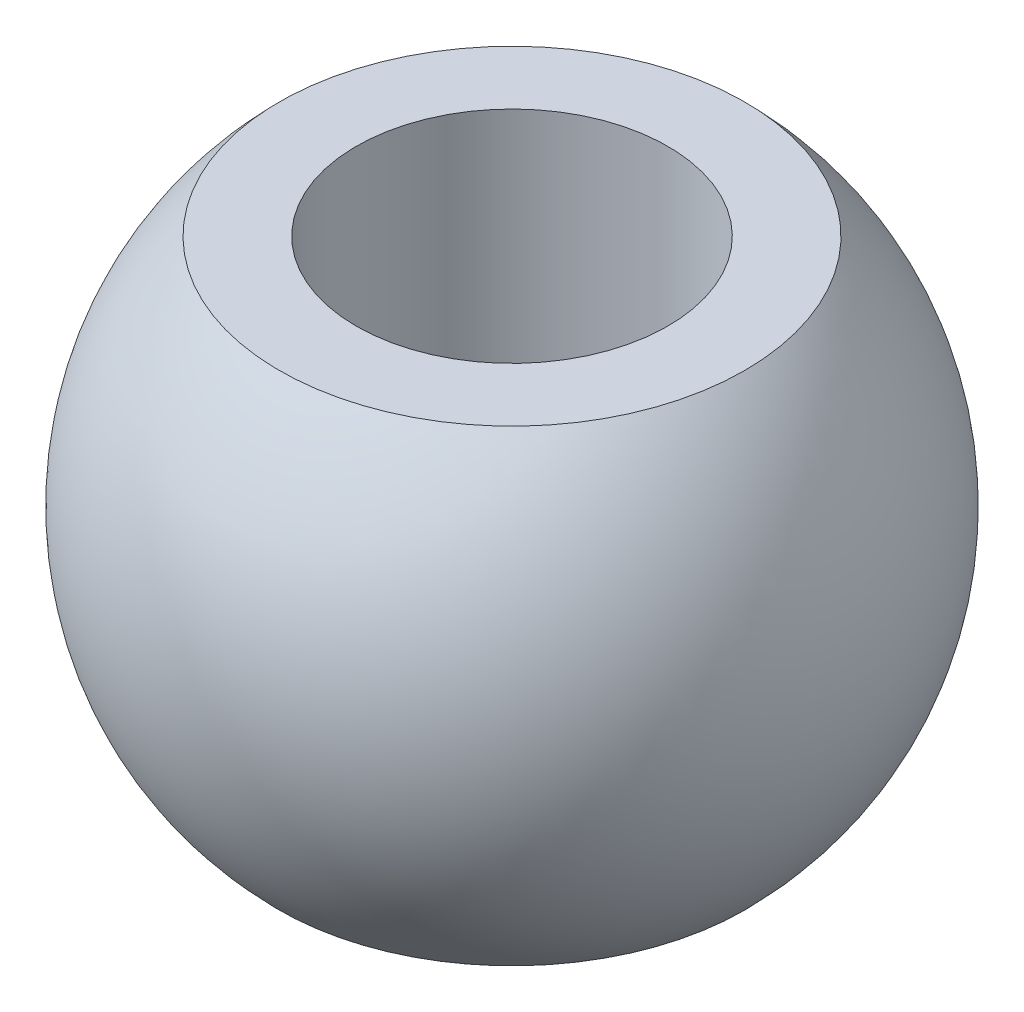
from build123d import *


with BuildPart() as part:
    # Sketch1 → Revolve1 (revolve)
    with BuildSketch(Plane(origin=(0, 0, 0), x_dir=(-1, 0, 0), z_dir=(0, 0, -1))):
        with BuildLine():
            Line((-4.480234369, -4.5), (-3, -4.5))
            Line((-3, -4.5), (-3, 4.5))
            Line((-3, 4.5), (-4.480234369, 4.5))
            ThreePointArc((-4.480234369, 4.5), (-6.35, 0), (-4.480234369, -4.5))
        make_face()
    revolve(axis=Axis((0, -4.5, 0), (0, 1, 0)))


solid = part.part
